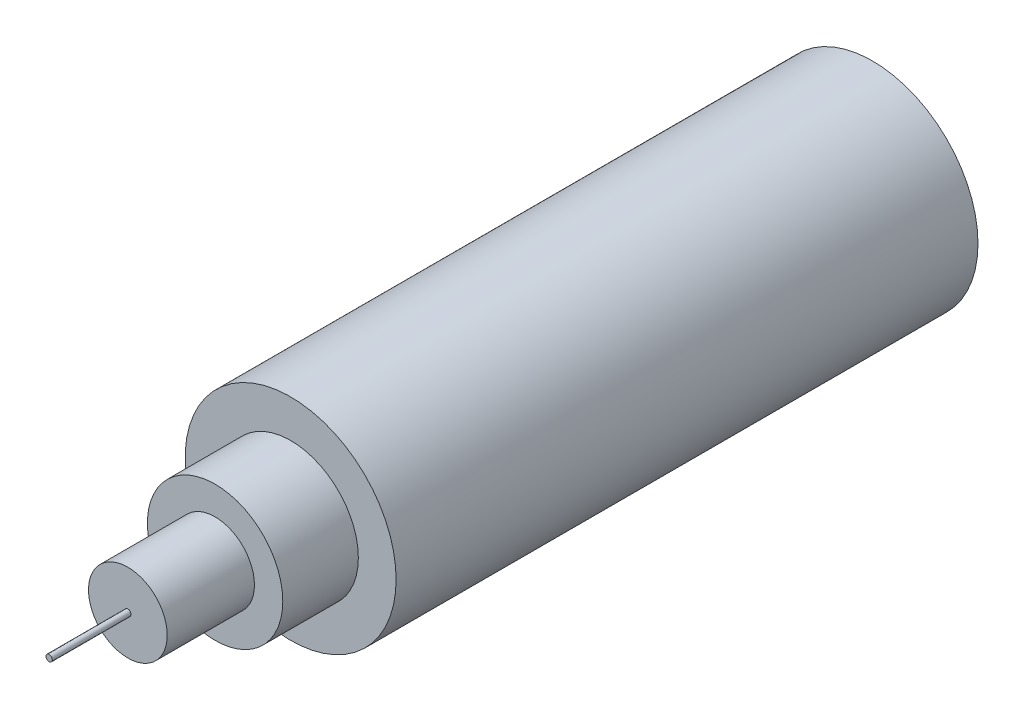
from build123d import *

# Parameters (mm, degrees)
SKETCH1_R           = 33.5
BOSS_EXTRUDE1_DEPTH = 184.8
SKETCH2_R           = 21.5
BOSS_EXTRUDE2_DEPTH = 24
SKETCH3_R           = 12.5
BOSS_EXTRUDE3_DEPTH = 27.7
SKETCH4_R           = 1
BOSS_EXTRUDE4_DEPTH = 25


with BuildPart() as part:
    # Sketch1 → Boss-Extrude1 (new body)
    with BuildSketch(Plane.XY):
        Circle(SKETCH1_R)
    extrude(amount=BOSS_EXTRUDE1_DEPTH)

    # Sketch2 → Boss-Extrude2 (add)
    with BuildSketch(Plane.XY.offset(184.8)):
        Circle(SKETCH2_R)
    extrude(amount=BOSS_EXTRUDE2_DEPTH)

    # Sketch3 → Boss-Extrude3 (add)
    with BuildSketch(Plane.XY.offset(208.8)):
        Circle(SKETCH3_R)
    extrude(amount=BOSS_EXTRUDE3_DEPTH)

    # Sketch4 → Boss-Extrude4 (add)
    with BuildSketch(Plane.XY.offset(236.5)):
        Circle(SKETCH4_R)
    extrude(amount=BOSS_EXTRUDE4_DEPTH)


solid = part.part
